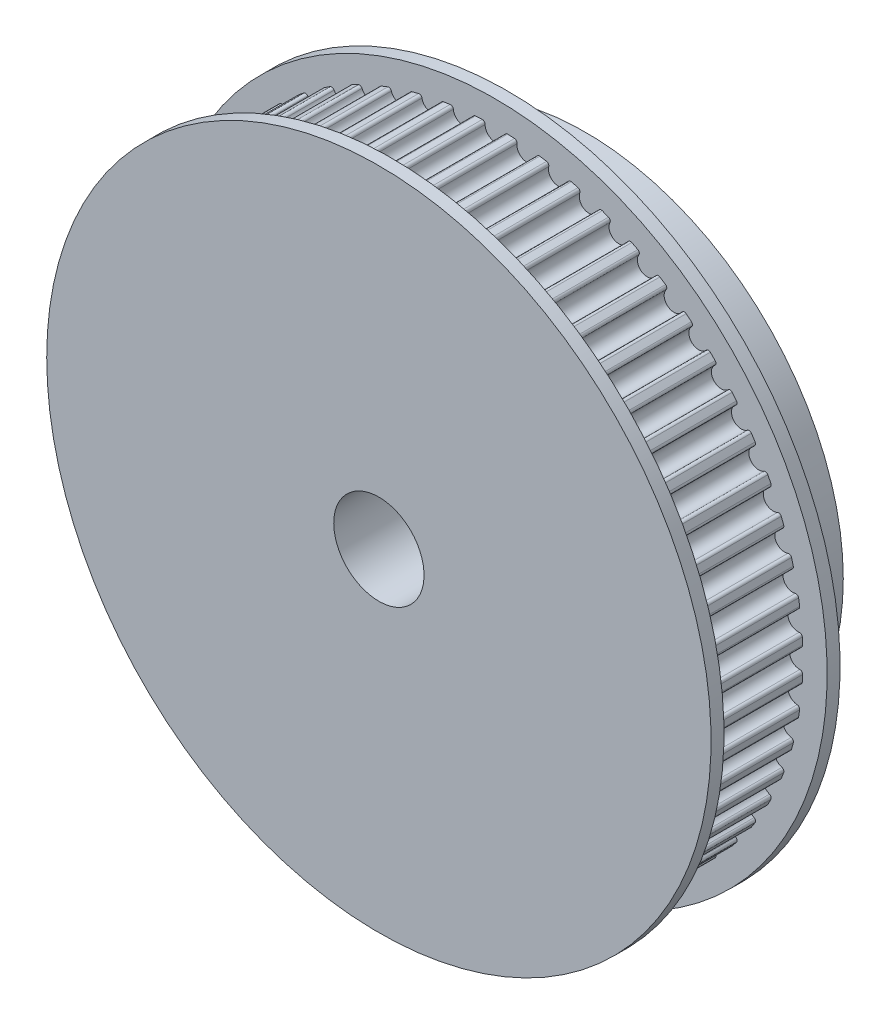
from build123d import *

# Parameters (mm, degrees)
BOSS_EXTRUDE1_DEPTH     = 16
SKETCH3_R               = 51.5
BOSS_EXTRUDE2_DEPTH     = 2
SKETCH4_R               = 40
BOSS_EXTRUDE3_DEPTH     = 12
SKETCH5_R               = 7
CUT_EXTRUDE1_DEPTH      = 80.551869871
CUT_EXTRUDE2_DEPTH      = 76.023329705
CUT_EXTRUDE2_DEPTH_BACK = 76.023329705
SKETCH7_R               = 2


with BuildPart() as part:
    # Sketch1 → Boss-Extrude1 (new body)
    with BuildSketch(Plane.XY):
        with BuildLine():
            ThreePointArc((3.025566719, 47.64903956), (2.498780231, 47.679567137), (1.971688534, 47.704270976))
            ThreePointArc((1.971688534, 47.704270976), (1.651130395, 47.579943701), (1.524166246, 47.260420781))
            ThreePointArc((1.524166246, 47.260420781), (1.096019318, 46.149638432), (0, 45.685))
            ThreePointArc((0, 45.685), (-1.096019318, 46.149638432), (-1.524166246, 47.260420781))
            ThreePointArc((-1.524166246, 47.260420781), (-1.651130395, 47.579943701), (-1.971688534, 47.704270976))
            ThreePointArc((-1.971688534, 47.704270976), (-2.498780231, 47.679567137), (-3.025566719, 47.64903956))
            ThreePointArc((-3.025566719, 47.64903956), (-3.331373067, 47.491885914), (-3.424242454, 47.160842007))
            ThreePointArc((-3.424242454, 47.160842007), (-3.733935576, 46.011391099), (-4.775382844, 45.43473279))
            ThreePointArc((-4.775382844, 45.43473279), (-5.913965995, 45.782260669), (-6.455875861, 46.842204496))
            ThreePointArc((-6.455875861, 46.842204496), (-6.615543727, 47.146705668), (-6.947341554, 47.236844415))
            ThreePointArc((-6.947341554, 47.236844415), (-7.468963533, 47.157179822), (-7.989673229, 47.071755296))
            ThreePointArc((-7.989673229, 47.071755296), (-8.277377309, 46.883497086), (-8.335134437, 46.544559178))
            ThreePointArc((-8.335134437, 46.544559178), (-8.522980691, 45.369033337), (-9.498445595, 44.68667314))
            ThreePointArc((-9.498445595, 44.68667314), (-10.667118024, 44.913282878), (-11.31685355, 45.910775216))
            ThreePointArc((-11.31685355, 45.910775216), (-11.507475778, 46.196918462), (-11.846878046, 46.251881103))
            ThreePointArc((-11.846878046, 46.251881103), (-12.357315308, 46.118128576), (-12.866243208, 45.978743031))
            ThreePointArc((-12.866243208, 45.978743031), (-13.132692873, 45.761442854), (-13.154704943, 45.418324419))
            ThreePointArc((-13.154704943, 45.418324419), (-13.218646245, 44.229602951), (-14.117441388, 43.449016947))
            ThreePointArc((-14.117441388, 43.449016947), (-15.303398874, 43.55222576), (-16.053841423, 44.476337875))
            ThreePointArc((-16.053841423, 44.476337875), (-16.273329517, 44.74098815), (-16.616617664, 44.760172502))
            ThreePointArc((-16.616617664, 44.760172502), (-17.110277751, 44.573797463), (-17.601847933, 44.381978035))
            ThreePointArc((-17.601847933, 44.381978035), (-17.844123906, 44.138016677), (-17.830149748, 43.794476993))
            ThreePointArc((-17.830149748, 43.794476993), (-17.769485546, 42.60558378), (-18.581763539, 41.735324232))
            ThreePointArc((-18.581763539, 41.735324232), (-19.772012485, 41.714001343), (-20.61494005, 42.554608469))
            ThreePointArc((-20.61494005, 42.554608469), (-20.860889251, 42.794866209), (-21.204302141, 42.778062085))
            ThreePointArc((-21.204302141, 42.778062085), (-21.67577641, 42.541106497), (-22.144603129, 42.298954801))
            ThreePointArc((-22.144603129, 42.298954801), (-22.360050983, 42.031005153), (-22.310243702, 41.690808113))
            ThreePointArc((-22.310243702, 41.690808113), (-22.125638644, 40.514768917), (-22.8425, 39.564370572))
            ThreePointArc((-22.8425, 39.564370572), (-24.023999789, 39.418749599), (-24.950177079, 40.166641867))
            ThreePointArc((-24.950177079, 40.166641867), (-25.219892718, 40.379874758), (-25.559667846, 40.327266267))
            ThreePointArc((-25.559667846, 40.327266267), (-26.003790727, 40.042326267), (-26.44473742, 39.752495366))
            ThreePointArc((-26.44473742, 39.752495366), (-26.630996663, 39.463493141), (-26.545901957, 39.130366015))
            ThreePointArc((-26.545901957, 39.130366015), (-26.239378615, 37.980065767), (-26.852969251, 36.959941388))
            ThreePointArc((-26.852969251, 36.959941388), (-28.012775124, 36.691617785), (-29.012054748, 37.338601132))
            ThreePointArc((-29.012054748, 37.338601132), (-29.302581762, 37.52247295), (-29.634996482, 37.434636481))
            ThreePointArc((-29.634996482, 37.434636481), (-30.046902071, 37.10483393), (-30.455137633, 36.770499273))
            ThreePointArc((-30.455137633, 36.770499273), (-30.61016757, 36.46361084), (-30.490717756, 36.141203438))
            ThreePointArc((-30.490717756, 36.141203438), (-30.065634463, 35.02924507), (-30.569231752, 33.950571352))
            ThreePointArc((-30.569231752, 33.950571352), (-31.694636632, 33.562484928), (-32.756070273, 34.101470869))
            ThreePointArc((-32.756070273, 34.101470869), (-33.064225589, 34.253967075), (-33.385637895, 34.131864985))
            ThreePointArc((-33.385637895, 34.131864985), (-33.760813268, 33.760813268), (-34.131864985, 33.385637895))
            ThreePointArc((-34.131864985, 33.385637895), (-34.253967075, 33.064225589), (-34.101470869, 32.756070273))
            ThreePointArc((-34.101470869, 32.756070273), (-33.562484928, 31.694636632), (-33.950571352, 30.569231752))
            ThreePointArc((-33.950571352, 30.569231752), (-35.02924507, 30.065634463), (-36.141203438, 30.490717756))
            ThreePointArc((-36.141203438, 30.490717756), (-36.46361084, 30.61016757), (-36.770499273, 30.455137633))
            ThreePointArc((-36.770499273, 30.455137633), (-37.10483393, 30.046902071), (-37.434636481, 29.634996482))
            ThreePointArc((-37.434636481, 29.634996482), (-37.52247295, 29.302581762), (-37.338601132, 29.012054748))
            ThreePointArc((-37.338601132, 29.012054748), (-36.691617785, 28.012775124), (-36.959941388, 26.852969251))
            ThreePointArc((-36.959941388, 26.852969251), (-37.980065767, 26.239378615), (-39.130366015, 26.545901957))
            ThreePointArc((-39.130366015, 26.545901957), (-39.463493141, 26.630996663), (-39.752495366, 26.44473742))
            ThreePointArc((-39.752495366, 26.44473742), (-40.042326267, 26.003790727), (-40.327266267, 25.559667846))
            ThreePointArc((-40.327266267, 25.559667846), (-40.379874758, 25.219892718), (-40.166641867, 24.950177079))
            ThreePointArc((-40.166641867, 24.950177079), (-39.418749599, 24.023999789), (-39.564370572, 22.8425))
            ThreePointArc((-39.564370572, 22.8425), (-40.514768917, 22.125638644), (-41.690808113, 22.310243702))
            ThreePointArc((-41.690808113, 22.310243702), (-42.031005153, 22.360050983), (-42.298954801, 22.144603129))
            ThreePointArc((-42.298954801, 22.144603129), (-42.541106497, 21.67577641), (-42.778062085, 21.204302141))
            ThreePointArc((-42.778062085, 21.204302141), (-42.794866209, 20.860889251), (-42.554608469, 20.61494005))
            ThreePointArc((-42.554608469, 20.61494005), (-41.714001343, 19.772012485), (-41.735324232, 18.581763539))
            ThreePointArc((-41.735324232, 18.581763539), (-42.60558378, 17.769485546), (-43.794476993, 17.830149748))
            ThreePointArc((-43.794476993, 17.830149748), (-44.138016677, 17.844123906), (-44.381978035, 17.601847933))
            ThreePointArc((-44.381978035, 17.601847933), (-44.573797463, 17.110277751), (-44.760172502, 16.616617664))
            ThreePointArc((-44.760172502, 16.616617664), (-44.74098815, 16.273329517), (-44.476337875, 16.053841423))
            ThreePointArc((-44.476337875, 16.053841423), (-43.55222576, 15.303398874), (-43.449016947, 14.117441388))
            ThreePointArc((-43.449016947, 14.117441388), (-44.229602951, 13.218646245), (-45.418324419, 13.154704943))
            ThreePointArc((-45.418324419, 13.154704943), (-45.761442854, 13.132692873), (-45.978743031, 12.866243208))
            ThreePointArc((-45.978743031, 12.866243208), (-46.118128576, 12.357315308), (-46.251881103, 11.846878046))
            ThreePointArc((-46.251881103, 11.846878046), (-46.196918462, 11.507475778), (-45.910775216, 11.31685355))
            ThreePointArc((-45.910775216, 11.31685355), (-44.913282878, 10.667118024), (-44.68667314, 9.498445595))
            ThreePointArc((-44.68667314, 9.498445595), (-45.369033337, 8.522980691), (-46.544559178, 8.335134437))
            ThreePointArc((-46.544559178, 8.335134437), (-46.883497086, 8.277377309), (-47.071755296, 7.989673229))
            ThreePointArc((-47.071755296, 7.989673229), (-47.157179822, 7.468963533), (-47.236844415, 6.947341554))
            ThreePointArc((-47.236844415, 6.947341554), (-47.146705668, 6.615543727), (-46.842204496, 6.455875861))
            ThreePointArc((-46.842204496, 6.455875861), (-45.782260669, 5.913965995), (-45.43473279, 4.775382844))
            ThreePointArc((-45.43473279, 4.775382844), (-46.011391099, 3.733935576), (-47.160842007, 3.424242454))
            ThreePointArc((-47.160842007, 3.424242454), (-47.491885914, 3.331373067), (-47.64903956, 3.025566719))
            ThreePointArc((-47.64903956, 3.025566719), (-47.679567137, 2.498780231), (-47.704270976, 1.971688534))
            ThreePointArc((-47.704270976, 1.971688534), (-47.579943701, 1.651130395), (-47.260420781, 1.524166246))
            ThreePointArc((-47.260420781, 1.524166246), (-46.149638432, 1.096019318), (-45.685, 0))
            ThreePointArc((-45.685, 0), (-46.149638432, -1.096019318), (-47.260420781, -1.524166246))
            ThreePointArc((-47.260420781, -1.524166246), (-47.579943701, -1.651130395), (-47.704270976, -1.971688534))
            ThreePointArc((-47.704270976, -1.971688534), (-47.679567137, -2.498780231), (-47.64903956, -3.025566719))
            ThreePointArc((-47.64903956, -3.025566719), (-47.491885914, -3.331373067), (-47.160842007, -3.424242454))
            ThreePointArc((-47.160842007, -3.424242454), (-46.011391099, -3.733935576), (-45.43473279, -4.775382844))
            ThreePointArc((-45.43473279, -4.775382844), (-45.782260669, -5.913965995), (-46.842204496, -6.455875861))
            ThreePointArc((-46.842204496, -6.455875861), (-47.146705668, -6.615543727), (-47.236844415, -6.947341554))
            ThreePointArc((-47.236844415, -6.947341554), (-47.157179822, -7.468963533), (-47.071755296, -7.989673229))
            ThreePointArc((-47.071755296, -7.989673229), (-46.883497086, -8.277377309), (-46.544559178, -8.335134437))
            ThreePointArc((-46.544559178, -8.335134437), (-45.369033337, -8.522980691), (-44.68667314, -9.498445595))
            ThreePointArc((-44.68667314, -9.498445595), (-44.913282878, -10.667118024), (-45.910775216, -11.31685355))
            ThreePointArc((-45.910775216, -11.31685355), (-46.196918462, -11.507475778), (-46.251881103, -11.846878046))
            ThreePointArc((-46.251881103, -11.846878046), (-46.118128576, -12.357315308), (-45.978743031, -12.866243208))
            ThreePointArc((-45.978743031, -12.866243208), (-45.761442854, -13.132692873), (-45.418324419, -13.154704943))
            ThreePointArc((-45.418324419, -13.154704943), (-44.229602951, -13.218646245), (-43.449016947, -14.117441388))
            ThreePointArc((-43.449016947, -14.117441388), (-43.55222576, -15.303398874), (-44.476337875, -16.053841423))
            ThreePointArc((-44.476337875, -16.053841423), (-44.74098815, -16.273329517), (-44.760172502, -16.616617664))
            ThreePointArc((-44.760172502, -16.616617664), (-44.573797463, -17.110277751), (-44.381978035, -17.601847933))
            ThreePointArc((-44.381978035, -17.601847933), (-44.138016677, -17.844123906), (-43.794476993, -17.830149748))
            ThreePointArc((-43.794476993, -17.830149748), (-42.60558378, -17.769485546), (-41.735324232, -18.581763539))
            ThreePointArc((-41.735324232, -18.581763539), (-41.714001343, -19.772012485), (-42.554608469, -20.61494005))
            ThreePointArc((-42.554608469, -20.61494005), (-42.794866209, -20.860889251), (-42.778062085, -21.204302141))
            ThreePointArc((-42.778062085, -21.204302141), (-42.541106497, -21.67577641), (-42.298954801, -22.144603129))
            ThreePointArc((-42.298954801, -22.144603129), (-42.031005153, -22.360050983), (-41.690808113, -22.310243702))
            ThreePointArc((-41.690808113, -22.310243702), (-40.514768917, -22.125638644), (-39.564370572, -22.8425))
            ThreePointArc((-39.564370572, -22.8425), (-39.418749599, -24.023999789), (-40.166641867, -24.950177079))
            ThreePointArc((-40.166641867, -24.950177079), (-40.379874758, -25.219892718), (-40.327266267, -25.559667846))
            ThreePointArc((-40.327266267, -25.559667846), (-40.042326267, -26.003790727), (-39.752495366, -26.44473742))
            ThreePointArc((-39.752495366, -26.44473742), (-39.463493141, -26.630996663), (-39.130366015, -26.545901957))
            ThreePointArc((-39.130366015, -26.545901957), (-37.980065767, -26.239378615), (-36.959941388, -26.852969251))
            ThreePointArc((-36.959941388, -26.852969251), (-36.691617785, -28.012775124), (-37.338601132, -29.012054748))
            ThreePointArc((-37.338601132, -29.012054748), (-37.52247295, -29.302581762), (-37.434636481, -29.634996482))
            ThreePointArc((-37.434636481, -29.634996482), (-37.10483393, -30.046902071), (-36.770499273, -30.455137633))
            ThreePointArc((-36.770499273, -30.455137633), (-36.46361084, -30.61016757), (-36.141203438, -30.490717756))
            ThreePointArc((-36.141203438, -30.490717756), (-35.02924507, -30.065634463), (-33.950571352, -30.569231752))
            ThreePointArc((-33.950571352, -30.569231752), (-33.562484928, -31.694636632), (-34.101470869, -32.756070273))
            ThreePointArc((-34.101470869, -32.756070273), (-34.253967075, -33.064225589), (-34.131864985, -33.385637895))
            ThreePointArc((-34.131864985, -33.385637895), (-33.760813268, -33.760813268), (-33.385637895, -34.131864985))
            ThreePointArc((-33.385637895, -34.131864985), (-33.064225589, -34.253967075), (-32.756070273, -34.101470869))
            ThreePointArc((-32.756070273, -34.101470869), (-31.694636632, -33.562484928), (-30.569231752, -33.950571352))
            ThreePointArc((-30.569231752, -33.950571352), (-30.065634463, -35.02924507), (-30.490717756, -36.141203438))
            ThreePointArc((-30.490717756, -36.141203438), (-30.61016757, -36.46361084), (-30.455137633, -36.770499273))
            ThreePointArc((-30.455137633, -36.770499273), (-30.046902071, -37.10483393), (-29.634996482, -37.434636481))
            ThreePointArc((-29.634996482, -37.434636481), (-29.302581762, -37.52247295), (-29.012054748, -37.338601132))
            ThreePointArc((-29.012054748, -37.338601132), (-28.012775124, -36.691617785), (-26.852969251, -36.959941388))
            ThreePointArc((-26.852969251, -36.959941388), (-26.239378615, -37.980065767), (-26.545901957, -39.130366015))
            ThreePointArc((-26.545901957, -39.130366015), (-26.630996663, -39.463493141), (-26.44473742, -39.752495366))
            ThreePointArc((-26.44473742, -39.752495366), (-26.003790727, -40.042326267), (-25.559667846, -40.327266267))
            ThreePointArc((-25.559667846, -40.327266267), (-25.219892718, -40.379874758), (-24.950177079, -40.166641867))
            ThreePointArc((-24.950177079, -40.166641867), (-24.023999789, -39.418749599), (-22.8425, -39.564370572))
            ThreePointArc((-22.8425, -39.564370572), (-22.125638644, -40.514768917), (-22.310243702, -41.690808113))
            ThreePointArc((-22.310243702, -41.690808113), (-22.360050983, -42.031005153), (-22.144603129, -42.298954801))
            ThreePointArc((-22.144603129, -42.298954801), (-21.67577641, -42.541106497), (-21.204302141, -42.778062085))
            ThreePointArc((-21.204302141, -42.778062085), (-20.860889251, -42.794866209), (-20.61494005, -42.554608469))
            ThreePointArc((-20.61494005, -42.554608469), (-19.772012485, -41.714001343), (-18.581763539, -41.735324232))
            ThreePointArc((-18.581763539, -41.735324232), (-17.769485546, -42.60558378), (-17.830149748, -43.794476993))
            ThreePointArc((-17.830149748, -43.794476993), (-17.844123906, -44.138016677), (-17.601847933, -44.381978035))
            ThreePointArc((-17.601847933, -44.381978035), (-17.110277751, -44.573797463), (-16.616617664, -44.760172502))
            ThreePointArc((-16.616617664, -44.760172502), (-16.273329517, -44.74098815), (-16.053841423, -44.476337875))
            ThreePointArc((-16.053841423, -44.476337875), (-15.303398874, -43.55222576), (-14.117441388, -43.449016947))
            ThreePointArc((-14.117441388, -43.449016947), (-13.218646245, -44.229602951), (-13.154704943, -45.418324419))
            ThreePointArc((-13.154704943, -45.418324419), (-13.132692873, -45.761442854), (-12.866243208, -45.978743031))
            ThreePointArc((-12.866243208, -45.978743031), (-12.357315308, -46.118128576), (-11.846878046, -46.251881103))
            ThreePointArc((-11.846878046, -46.251881103), (-11.507475778, -46.196918462), (-11.31685355, -45.910775216))
            ThreePointArc((-11.31685355, -45.910775216), (-10.667118024, -44.913282878), (-9.498445595, -44.68667314))
            ThreePointArc((-9.498445595, -44.68667314), (-8.522980691, -45.369033337), (-8.335134437, -46.544559178))
            ThreePointArc((-8.335134437, -46.544559178), (-8.277377309, -46.883497086), (-7.989673229, -47.071755296))
            ThreePointArc((-7.989673229, -47.071755296), (-7.468963533, -47.157179822), (-6.947341554, -47.236844415))
            ThreePointArc((-6.947341554, -47.236844415), (-6.615543727, -47.146705668), (-6.455875861, -46.842204496))
            ThreePointArc((-6.455875861, -46.842204496), (-5.913965995, -45.782260669), (-4.775382844, -45.43473279))
            ThreePointArc((-4.775382844, -45.43473279), (-3.733935576, -46.011391099), (-3.424242454, -47.160842007))
            ThreePointArc((-3.424242454, -47.160842007), (-3.331373067, -47.491885914), (-3.025566719, -47.64903956))
            ThreePointArc((-3.025566719, -47.64903956), (-2.498780231, -47.679567137), (-1.971688534, -47.704270976))
            ThreePointArc((-1.971688534, -47.704270976), (-1.651130395, -47.579943701), (-1.524166246, -47.260420781))
            ThreePointArc((-1.524166246, -47.260420781), (-1.096019318, -46.149638432), (0, -45.685))
            ThreePointArc((0, -45.685), (1.096019318, -46.149638432), (1.524166246, -47.260420781))
            ThreePointArc((1.524166246, -47.260420781), (1.651130395, -47.579943701), (1.971688534, -47.704270976))
            ThreePointArc((1.971688534, -47.704270976), (2.498780231, -47.679567137), (3.025566719, -47.64903956))
            ThreePointArc((3.025566719, -47.64903956), (3.331373067, -47.491885914), (3.424242454, -47.160842007))
            ThreePointArc((3.424242454, -47.160842007), (3.733935576, -46.011391099), (4.775382844, -45.43473279))
            ThreePointArc((4.775382844, -45.43473279), (5.913965995, -45.782260669), (6.455875861, -46.842204496))
            ThreePointArc((6.455875861, -46.842204496), (6.615543727, -47.146705668), (6.947341554, -47.236844415))
            ThreePointArc((6.947341554, -47.236844415), (7.468963533, -47.157179822), (7.989673229, -47.071755296))
            ThreePointArc((7.989673229, -47.071755296), (8.277377309, -46.883497086), (8.335134437, -46.544559178))
            ThreePointArc((8.335134437, -46.544559178), (8.522980691, -45.369033337), (9.498445595, -44.68667314))
            ThreePointArc((9.498445595, -44.68667314), (10.667118024, -44.913282878), (11.31685355, -45.910775216))
            ThreePointArc((11.31685355, -45.910775216), (11.507475778, -46.196918462), (11.846878046, -46.251881103))
            ThreePointArc((11.846878046, -46.251881103), (12.357315308, -46.118128576), (12.866243208, -45.978743031))
            ThreePointArc((12.866243208, -45.978743031), (13.132692873, -45.761442854), (13.154704943, -45.418324419))
            ThreePointArc((13.154704943, -45.418324419), (13.218646245, -44.229602951), (14.117441388, -43.449016947))
            ThreePointArc((14.117441388, -43.449016947), (15.303398874, -43.55222576), (16.053841423, -44.476337875))
            ThreePointArc((16.053841423, -44.476337875), (16.273329517, -44.74098815), (16.616617664, -44.760172502))
            ThreePointArc((16.616617664, -44.760172502), (17.110277751, -44.573797463), (17.601847933, -44.381978035))
            ThreePointArc((17.601847933, -44.381978035), (17.844123906, -44.138016677), (17.830149748, -43.794476993))
            ThreePointArc((17.830149748, -43.794476993), (17.769485546, -42.60558378), (18.581763539, -41.735324232))
            ThreePointArc((18.581763539, -41.735324232), (19.772012485, -41.714001343), (20.61494005, -42.554608469))
            ThreePointArc((20.61494005, -42.554608469), (20.860889251, -42.794866209), (21.204302141, -42.778062085))
            ThreePointArc((21.204302141, -42.778062085), (21.67577641, -42.541106497), (22.144603129, -42.298954801))
            ThreePointArc((22.144603129, -42.298954801), (22.360050983, -42.031005153), (22.310243702, -41.690808113))
            ThreePointArc((22.310243702, -41.690808113), (22.125638644, -40.514768917), (22.8425, -39.564370572))
            ThreePointArc((22.8425, -39.564370572), (24.023999789, -39.418749599), (24.950177079, -40.166641867))
            ThreePointArc((24.950177079, -40.166641867), (25.219892718, -40.379874758), (25.559667846, -40.327266267))
            ThreePointArc((25.559667846, -40.327266267), (26.003790727, -40.042326267), (26.44473742, -39.752495366))
            ThreePointArc((26.44473742, -39.752495366), (26.630996663, -39.463493141), (26.545901957, -39.130366015))
            ThreePointArc((26.545901957, -39.130366015), (26.239378615, -37.980065767), (26.852969251, -36.959941388))
            ThreePointArc((26.852969251, -36.959941388), (28.012775124, -36.691617785), (29.012054748, -37.338601132))
            ThreePointArc((29.012054748, -37.338601132), (29.302581762, -37.52247295), (29.634996482, -37.434636481))
            ThreePointArc((29.634996482, -37.434636481), (30.046902071, -37.10483393), (30.455137633, -36.770499273))
            ThreePointArc((30.455137633, -36.770499273), (30.61016757, -36.46361084), (30.490717756, -36.141203438))
            ThreePointArc((30.490717756, -36.141203438), (30.065634463, -35.02924507), (30.569231752, -33.950571352))
            ThreePointArc((30.569231752, -33.950571352), (31.694636632, -33.562484928), (32.756070273, -34.101470869))
            ThreePointArc((32.756070273, -34.101470869), (33.064225589, -34.253967075), (33.385637895, -34.131864985))
            ThreePointArc((33.385637895, -34.131864985), (33.760813268, -33.760813268), (34.131864985, -33.385637895))
            ThreePointArc((34.131864985, -33.385637895), (34.253967075, -33.064225589), (34.101470869, -32.756070273))
            ThreePointArc((34.101470869, -32.756070273), (33.562484928, -31.694636632), (33.950571352, -30.569231752))
            ThreePointArc((33.950571352, -30.569231752), (35.02924507, -30.065634463), (36.141203438, -30.490717756))
            ThreePointArc((36.141203438, -30.490717756), (36.46361084, -30.61016757), (36.770499273, -30.455137633))
            ThreePointArc((36.770499273, -30.455137633), (37.10483393, -30.046902071), (37.434636481, -29.634996482))
            ThreePointArc((37.434636481, -29.634996482), (37.52247295, -29.302581762), (37.338601132, -29.012054748))
            ThreePointArc((37.338601132, -29.012054748), (36.691617785, -28.012775124), (36.959941388, -26.852969251))
            ThreePointArc((36.959941388, -26.852969251), (37.980065767, -26.239378615), (39.130366015, -26.545901957))
            ThreePointArc((39.130366015, -26.545901957), (39.463493141, -26.630996663), (39.752495366, -26.44473742))
            ThreePointArc((39.752495366, -26.44473742), (40.042326267, -26.003790727), (40.327266267, -25.559667846))
            ThreePointArc((40.327266267, -25.559667846), (40.379874758, -25.219892718), (40.166641867, -24.950177079))
            ThreePointArc((40.166641867, -24.950177079), (39.418749599, -24.023999789), (39.564370572, -22.8425))
            ThreePointArc((39.564370572, -22.8425), (40.514768917, -22.125638644), (41.690808113, -22.310243702))
            ThreePointArc((41.690808113, -22.310243702), (42.031005153, -22.360050983), (42.298954801, -22.144603129))
            ThreePointArc((42.298954801, -22.144603129), (42.541106497, -21.67577641), (42.778062085, -21.204302141))
            ThreePointArc((42.778062085, -21.204302141), (42.794866209, -20.860889251), (42.554608469, -20.61494005))
            ThreePointArc((42.554608469, -20.61494005), (41.714001343, -19.772012485), (41.735324232, -18.581763539))
            ThreePointArc((41.735324232, -18.581763539), (42.60558378, -17.769485546), (43.794476993, -17.830149748))
            ThreePointArc((43.794476993, -17.830149748), (44.138016677, -17.844123906), (44.381978035, -17.601847933))
            ThreePointArc((44.381978035, -17.601847933), (44.573797463, -17.110277751), (44.760172502, -16.616617664))
            ThreePointArc((44.760172502, -16.616617664), (44.74098815, -16.273329517), (44.476337875, -16.053841423))
            ThreePointArc((44.476337875, -16.053841423), (43.55222576, -15.303398874), (43.449016947, -14.117441388))
            ThreePointArc((43.449016947, -14.117441388), (44.229602951, -13.218646245), (45.418324419, -13.154704943))
            ThreePointArc((45.418324419, -13.154704943), (45.761442854, -13.132692873), (45.978743031, -12.866243208))
            ThreePointArc((45.978743031, -12.866243208), (46.118128576, -12.357315308), (46.251881103, -11.846878046))
            ThreePointArc((46.251881103, -11.846878046), (46.196918462, -11.507475778), (45.910775216, -11.31685355))
            ThreePointArc((45.910775216, -11.31685355), (44.913282878, -10.667118024), (44.68667314, -9.498445595))
            ThreePointArc((44.68667314, -9.498445595), (45.369033337, -8.522980691), (46.544559178, -8.335134437))
            ThreePointArc((46.544559178, -8.335134437), (46.883497086, -8.277377309), (47.071755296, -7.989673229))
            ThreePointArc((47.071755296, -7.989673229), (47.157179822, -7.468963533), (47.236844415, -6.947341554))
            ThreePointArc((47.236844415, -6.947341554), (47.146705668, -6.615543727), (46.842204496, -6.455875861))
            ThreePointArc((46.842204496, -6.455875861), (45.782260669, -5.913965995), (45.43473279, -4.775382844))
            ThreePointArc((45.43473279, -4.775382844), (46.011391099, -3.733935576), (47.160842007, -3.424242454))
            ThreePointArc((47.160842007, -3.424242454), (47.491885914, -3.331373067), (47.64903956, -3.025566719))
            ThreePointArc((47.64903956, -3.025566719), (47.679567137, -2.498780231), (47.704270976, -1.971688534))
            ThreePointArc((47.704270976, -1.971688534), (47.579943701, -1.651130395), (47.260420781, -1.524166246))
            ThreePointArc((47.260420781, -1.524166246), (46.149638432, -1.096019318), (45.685, 0))
            ThreePointArc((45.685, 0), (46.149638432, 1.096019318), (47.260420781, 1.524166246))
            ThreePointArc((47.260420781, 1.524166246), (47.579943701, 1.651130395), (47.704270976, 1.971688534))
            ThreePointArc((47.704270976, 1.971688534), (47.679567137, 2.498780231), (47.64903956, 3.025566719))
            ThreePointArc((47.64903956, 3.025566719), (47.491885914, 3.331373067), (47.160842007, 3.424242454))
            ThreePointArc((47.160842007, 3.424242454), (46.011391099, 3.733935576), (45.43473279, 4.775382844))
            ThreePointArc((45.43473279, 4.775382844), (45.782260669, 5.913965995), (46.842204496, 6.455875861))
            ThreePointArc((46.842204496, 6.455875861), (47.146705668, 6.615543727), (47.236844415, 6.947341554))
            ThreePointArc((47.236844415, 6.947341554), (47.157179822, 7.468963533), (47.071755296, 7.989673229))
            ThreePointArc((47.071755296, 7.989673229), (46.883497086, 8.277377309), (46.544559178, 8.335134437))
            ThreePointArc((46.544559178, 8.335134437), (45.369033337, 8.522980691), (44.68667314, 9.498445595))
            ThreePointArc((44.68667314, 9.498445595), (44.913282878, 10.667118024), (45.910775216, 11.31685355))
            ThreePointArc((45.910775216, 11.31685355), (46.196918462, 11.507475778), (46.251881103, 11.846878046))
            ThreePointArc((46.251881103, 11.846878046), (46.118128576, 12.357315308), (45.978743031, 12.866243208))
            ThreePointArc((45.978743031, 12.866243208), (45.761442854, 13.132692873), (45.418324419, 13.154704943))
            ThreePointArc((45.418324419, 13.154704943), (44.229602951, 13.218646245), (43.449016947, 14.117441388))
            ThreePointArc((43.449016947, 14.117441388), (43.55222576, 15.303398874), (44.476337875, 16.053841423))
            ThreePointArc((44.476337875, 16.053841423), (44.74098815, 16.273329517), (44.760172502, 16.616617664))
            ThreePointArc((44.760172502, 16.616617664), (44.573797463, 17.110277751), (44.381978035, 17.601847933))
            ThreePointArc((44.381978035, 17.601847933), (44.138016677, 17.844123906), (43.794476993, 17.830149748))
            ThreePointArc((43.794476993, 17.830149748), (42.60558378, 17.769485546), (41.735324232, 18.581763539))
            ThreePointArc((41.735324232, 18.581763539), (41.714001343, 19.772012485), (42.554608469, 20.61494005))
            ThreePointArc((42.554608469, 20.61494005), (42.794866209, 20.860889251), (42.778062085, 21.204302141))
            ThreePointArc((42.778062085, 21.204302141), (42.541106497, 21.67577641), (42.298954801, 22.144603129))
            ThreePointArc((42.298954801, 22.144603129), (42.031005153, 22.360050983), (41.690808113, 22.310243702))
            ThreePointArc((41.690808113, 22.310243702), (40.514768917, 22.125638644), (39.564370572, 22.8425))
            ThreePointArc((39.564370572, 22.8425), (39.418749599, 24.023999789), (40.166641867, 24.950177079))
            ThreePointArc((40.166641867, 24.950177079), (40.379874758, 25.219892718), (40.327266267, 25.559667846))
            ThreePointArc((40.327266267, 25.559667846), (40.042326267, 26.003790727), (39.752495366, 26.44473742))
            ThreePointArc((39.752495366, 26.44473742), (39.463493141, 26.630996663), (39.130366015, 26.545901957))
            ThreePointArc((39.130366015, 26.545901957), (37.980065767, 26.239378615), (36.959941388, 26.852969251))
            ThreePointArc((36.959941388, 26.852969251), (36.691617785, 28.012775124), (37.338601132, 29.012054748))
            ThreePointArc((37.338601132, 29.012054748), (37.52247295, 29.302581762), (37.434636481, 29.634996482))
            ThreePointArc((37.434636481, 29.634996482), (37.10483393, 30.046902071), (36.770499273, 30.455137633))
            ThreePointArc((36.770499273, 30.455137633), (36.46361084, 30.61016757), (36.141203438, 30.490717756))
            ThreePointArc((36.141203438, 30.490717756), (35.02924507, 30.065634463), (33.950571352, 30.569231752))
            ThreePointArc((33.950571352, 30.569231752), (33.562484928, 31.694636632), (34.101470869, 32.756070273))
            ThreePointArc((34.101470869, 32.756070273), (34.253967075, 33.064225589), (34.131864985, 33.385637895))
            ThreePointArc((34.131864985, 33.385637895), (33.760813268, 33.760813268), (33.385637895, 34.131864985))
            ThreePointArc((33.385637895, 34.131864985), (33.064225589, 34.253967075), (32.756070273, 34.101470869))
            ThreePointArc((32.756070273, 34.101470869), (31.694636632, 33.562484928), (30.569231752, 33.950571352))
            ThreePointArc((30.569231752, 33.950571352), (30.065634463, 35.02924507), (30.490717756, 36.141203438))
            ThreePointArc((30.490717756, 36.141203438), (30.61016757, 36.46361084), (30.455137633, 36.770499273))
            ThreePointArc((30.455137633, 36.770499273), (30.046902071, 37.10483393), (29.634996482, 37.434636481))
            ThreePointArc((29.634996482, 37.434636481), (29.302581762, 37.52247295), (29.012054748, 37.338601132))
            ThreePointArc((29.012054748, 37.338601132), (28.012775124, 36.691617785), (26.852969251, 36.959941388))
            ThreePointArc((26.852969251, 36.959941388), (26.239378615, 37.980065767), (26.545901957, 39.130366015))
            ThreePointArc((26.545901957, 39.130366015), (26.630996663, 39.463493141), (26.44473742, 39.752495366))
            ThreePointArc((26.44473742, 39.752495366), (26.003790727, 40.042326267), (25.559667846, 40.327266267))
            ThreePointArc((25.559667846, 40.327266267), (25.219892718, 40.379874758), (24.950177079, 40.166641867))
            ThreePointArc((24.950177079, 40.166641867), (24.023999789, 39.418749599), (22.8425, 39.564370572))
            ThreePointArc((22.8425, 39.564370572), (22.125638644, 40.514768917), (22.310243702, 41.690808113))
            ThreePointArc((22.310243702, 41.690808113), (22.360050983, 42.031005153), (22.144603129, 42.298954801))
            ThreePointArc((22.144603129, 42.298954801), (21.67577641, 42.541106497), (21.204302141, 42.778062085))
            ThreePointArc((21.204302141, 42.778062085), (20.860889251, 42.794866209), (20.61494005, 42.554608469))
            ThreePointArc((20.61494005, 42.554608469), (19.772012485, 41.714001343), (18.581763539, 41.735324232))
            ThreePointArc((18.581763539, 41.735324232), (17.769485546, 42.60558378), (17.830149748, 43.794476993))
            ThreePointArc((17.830149748, 43.794476993), (17.844123906, 44.138016677), (17.601847933, 44.381978035))
            ThreePointArc((17.601847933, 44.381978035), (17.110277751, 44.573797463), (16.616617664, 44.760172502))
            ThreePointArc((16.616617664, 44.760172502), (16.273329517, 44.74098815), (16.053841423, 44.476337875))
            ThreePointArc((16.053841423, 44.476337875), (15.303398874, 43.55222576), (14.117441388, 43.449016947))
            ThreePointArc((14.117441388, 43.449016947), (13.218646245, 44.229602951), (13.154704943, 45.418324419))
            ThreePointArc((13.154704943, 45.418324419), (13.132692873, 45.761442854), (12.866243208, 45.978743031))
            ThreePointArc((12.866243208, 45.978743031), (12.357315308, 46.118128576), (11.846878046, 46.251881103))
            ThreePointArc((11.846878046, 46.251881103), (11.507475778, 46.196918462), (11.31685355, 45.910775216))
            ThreePointArc((11.31685355, 45.910775216), (10.667118024, 44.913282878), (9.498445595, 44.68667314))
            ThreePointArc((9.498445595, 44.68667314), (8.522980691, 45.369033337), (8.335134437, 46.544559178))
            ThreePointArc((8.335134437, 46.544559178), (8.277377309, 46.883497086), (7.989673229, 47.071755296))
            ThreePointArc((7.989673229, 47.071755296), (7.468963533, 47.157179822), (6.947341554, 47.236844415))
            ThreePointArc((6.947341554, 47.236844415), (6.615543727, 47.146705668), (6.455875861, 46.842204496))
            ThreePointArc((6.455875861, 46.842204496), (5.913965995, 45.782260669), (4.775382844, 45.43473279))
            ThreePointArc((4.775382844, 45.43473279), (3.733935576, 46.011391099), (3.424242454, 47.160842007))
            ThreePointArc((3.424242454, 47.160842007), (3.331373067, 47.491885914), (3.025566719, 47.64903956))
        make_face()
    extrude(amount=BOSS_EXTRUDE1_DEPTH)

    # Sketch3 → Boss-Extrude2 (add)
    with BuildSketch(Plane(origin=(0, 0, 0), x_dir=(-1, 0, 0), z_dir=(0, 0, -1))):
        Circle(SKETCH3_R)
    boss_extrude2 = extrude(amount=BOSS_EXTRUDE2_DEPTH)

    # Mirror1: Boss-Extrude2 across plane
    add(boss_extrude2.mirror(Plane.XY.offset(8)))

    # Sketch4 → Boss-Extrude3 (add)
    with BuildSketch(Plane(origin=(0, 0, -2), x_dir=(-1, 0, 0), z_dir=(0, 0, -1))):
        Circle(SKETCH4_R)
    extrude(amount=BOSS_EXTRUDE3_DEPTH)

    # Sketch5 → Cut-Extrude1 (cut, through all)
    with BuildSketch(Plane(origin=(0, 0, -14), x_dir=(-1, 0, 0), z_dir=(0, 0, -1))):
        Circle(SKETCH5_R)
    extrude(amount=-CUT_EXTRUDE1_DEPTH, mode=Mode.SUBTRACT)

    # Sketch7 → Cut-Extrude2 (cut, two sides: drawn at the far end of the back side and taken through both)
    with BuildSketch(Plane(origin=(0, 0, 0), x_dir=(0, 0, -1), z_dir=(1, 0, 0)).offset(-CUT_EXTRUDE2_DEPTH_BACK)):
        with Locations((7.5, 0)):
            Circle(SKETCH7_R)
    extrude(amount=CUT_EXTRUDE2_DEPTH + CUT_EXTRUDE2_DEPTH_BACK, mode=Mode.SUBTRACT)


solid = part.part
